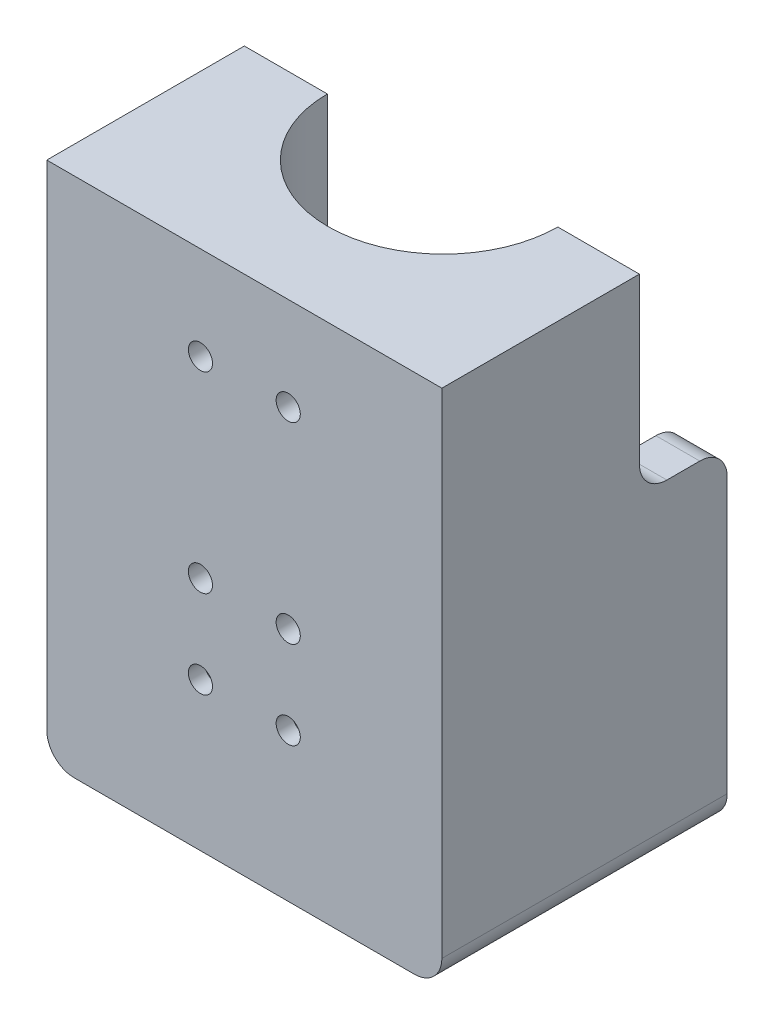
from build123d import *

# Parameters (mm, degrees)
BOSS_EXTRUDE1_DEPTH = 50
BOSS_EXTRUDE2_DEPTH = 35
SKETCH4_R           = 2.2
CUT_EXTRUDE1_DEPTH  = 35
SKETCH5_R           = 4
CUT_EXTRUDE2_DEPTH  = 5
SKETCH6_R           = 4
CUT_EXTRUDE3_DEPTH  = 34
SKETCH7_R           = 4
SKETCH7_R_2         = 2.2
BOSS_EXTRUDE3_DEPTH = 8
SKETCH8_W           = 72
SKETCH8_H           = 52
BOSS_EXTRUDE4_DEPTH = 10
FILLET1_R           = 5
CUT_EXTRUDE5_DEPTH  = 28
SKETCH11_R          = 11.145843878
SKETCH11_R_2        = 4
BOSS_EXTRUDE6_DEPTH = 3


with BuildPart() as part:
    # Sketch1 → Boss-Extrude1 (new body)
    with BuildSketch(Plane(origin=(0, 0, 0), x_dir=(1, 0, 0), z_dir=(0, 1, 0))):
        with BuildLine():
            Line((-28, 23.5), (-28, -8.5))
            ThreePointArc((-28, -8.5), (-24.485281374, -16.985281374), (-16, -20.5))
            Line((-16, -20.5), (16, -20.5))
            ThreePointArc((16, -20.5), (24.485281374, -16.985281374), (28, -8.5))
            Line((28, -8.5), (28, 23.5))
            Line((28, 23.5), (36, 23.5))
            Line((36, 23.5), (36, 15.5))
            Line((36, 15.5), (36, -8.5))
            Line((36, -8.5), (36, -28.5))
            Line((36, -28.5), (16, -28.5))
            Line((16, -28.5), (-16, -28.5))
            Line((-16, -28.5), (-36, -28.5))
            Line((-36, -28.5), (-36, -8.5))
            Line((-36, -8.5), (-36, 15.5))
            Line((-36, 15.5), (-36, 23.5))
            Line((-36, 23.5), (-28, 23.5))
        make_face()
    extrude(amount=BOSS_EXTRUDE1_DEPTH)

    # Sketch3 → Boss-Extrude2 (add)
    with BuildSketch(Plane(origin=(0, 50, 0), x_dir=(1, 0, 0), z_dir=(0, 1, 0))):
        with BuildLine():
            Line((-36, 7.5), (-36, -8.5))
            Line((-36, -8.5), (-36, -28.5))
            Line((-36, -28.5), (-16, -28.5))
            Line((-16, -28.5), (16, -28.5))
            Line((16, -28.5), (36, -28.5))
            Line((36, -28.5), (36, -8.5))
            Line((36, -8.5), (36, 7.5))
            Line((36, 7.5), (28, 7.5))
            Line((28, 7.5), (21.128428342, 7.5))
            ThreePointArc((21.128428342, 7.5), (0.128823476, -13.371176524), (-20.87078139, 7.5))
            Line((-20.87078139, 7.5), (-28, 7.5))
            Line((-28, 7.5), (-36, 7.5))
        make_face()
    extrude(amount=BOSS_EXTRUDE2_DEPTH)

    # Sketch4 → Cut-Extrude1 (cut)
    with BuildSketch(Plane(origin=(0, 0, 20.5), x_dir=(-1, 0, 0), z_dir=(0, 0, -1))):
        with Locations((8, 33)):
            Circle(SKETCH4_R)
        with Locations((-8, 33)):
            Circle(SKETCH4_R)
        with Locations((-8, 17)):
            Circle(SKETCH4_R)
        with Locations((8, 17)):
            Circle(SKETCH4_R)
    extrude(amount=-CUT_EXTRUDE1_DEPTH, mode=Mode.SUBTRACT)

    # Sketch5 → Cut-Extrude2 (cut)
    with BuildSketch(Plane(origin=(0, 0, 20.5), x_dir=(-1, 0, 0), z_dir=(0, 0, -1))):
        with Locations((-8, 17)):
            Circle(SKETCH5_R)
        with Locations((8, 17)):
            Circle(SKETCH5_R)
    extrude(amount=-CUT_EXTRUDE2_DEPTH, mode=Mode.SUBTRACT)

    # Sketch6 → Cut-Extrude3 (cut)
    with BuildSketch(Plane.XY.offset(28.5)):
        with Locations((-8, 68)):
            Circle(SKETCH6_R)
        with Locations((8, 68)):
            Circle(SKETCH6_R)
    extrude(amount=-CUT_EXTRUDE3_DEPTH, mode=Mode.SUBTRACT)

    # Sketch7 → Boss-Extrude3 (add)
    # profile 1 of 2: a face of its own
    with BuildSketch(Plane.XY.offset(28.5)):
        with Locations((-8, 68)):
            Circle(SKETCH7_R)
        with Locations((-8, 68)):
            Circle(SKETCH7_R_2, mode=Mode.SUBTRACT)
    # profile 2 of 2: a face of its own
    with BuildSketch(Plane.XY.offset(28.5)):
        with Locations((8, 68)):
            Circle(SKETCH7_R)
        with Locations((8, 68)):
            Circle(SKETCH7_R_2, mode=Mode.SUBTRACT)
    extrude(amount=-BOSS_EXTRUDE3_DEPTH)

    # Sketch8 → Boss-Extrude4 (add)
    with BuildSketch(Plane.XZ):
        with Locations((0, 2.5)):
            Rectangle(SKETCH8_W, SKETCH8_H)
    extrude(amount=BOSS_EXTRUDE4_DEPTH)

    # Fillet1
    fillet1_edges = [part.edges().sort_by_distance(p)[0] for p in [
        (-36, -10, 2.5),
        (36, -10, 2.5),
        (32, 50, -23.5),
        (32, 50, -7.5),
        (-32, 50, -23.5),
        (-32, 50, -7.5),
    ]]
    fillet(fillet1_edges, radius=FILLET1_R)

    # Sketch9 → Cut-Extrude5 (cut)
    with BuildSketch(Plane.XZ.offset(10)):
        Polygon((-3.635500279, -0.98), (-7.399824034, -7.5), (7.657470986, -7.5), (3.893147231, -0.98), align=None)
        Polygon((7.657470986, -7.5), (-7.399824034, -7.5), (-3.635500279, -14.02), (3.893147231, -14.02), align=None)
    extrude(amount=-CUT_EXTRUDE5_DEPTH, mode=Mode.SUBTRACT)

    # Sketch11 → Boss-Extrude6 (add)
    with BuildSketch(Plane(origin=(0, -10, 0), x_dir=(-1, 0, 0), z_dir=(0, -1, 0))):
        with Locations((-0.128823476, 7.5)):
            Circle(SKETCH11_R)
        with Locations(Location((-0.128823476, 7.5, 0), (0, 0, 90))):
            Circle(SKETCH11_R_2, mode=Mode.SUBTRACT)
    extrude(amount=-BOSS_EXTRUDE6_DEPTH)


solid = part.part
